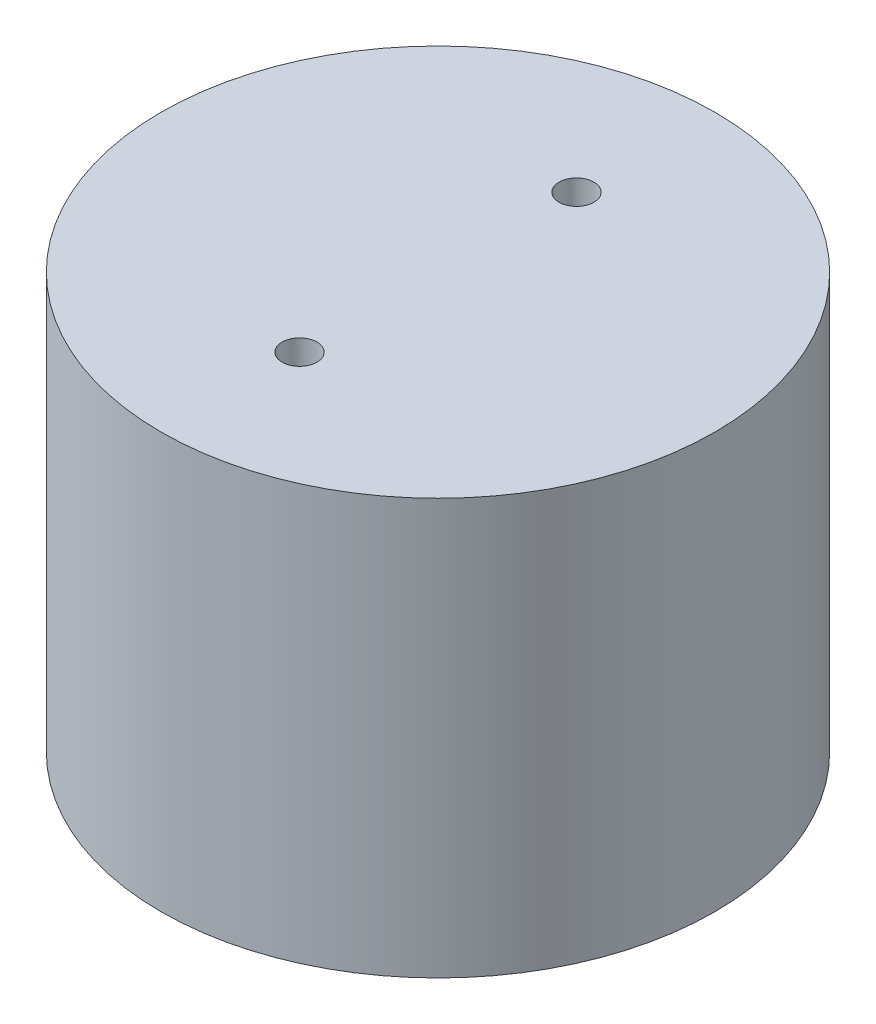
from build123d import *

# Parameters (mm, degrees)
SKETCH1_R                      = 25.4
BOSS_EXTRUDE1_DEPTH            = 38.1
F_1_4_20_TAPPED_HOLE4_D        = 5.1054
F_1_4_20_TAPPED_HOLE4_DEPTH    = 15.875
F_1_4_20_TAPPED_HOLE4_TIP      = 1.533816902
CBORE_FOR_M3_SHCS1_D           = 3.2
CBORE_FOR_M3_SHCS1_CBORE_D     = 6.5
CBORE_FOR_M3_SHCS1_CBORE_DEPTH = 4.999996


with BuildPart() as part:
    # Sketch1 → Boss-Extrude1 (new body)
    with BuildSketch(Plane(origin=(0, 0, 0), x_dir=(1, 0, 0), z_dir=(0, 1, 0))):
        Circle(SKETCH1_R)
    extrude(amount=BOSS_EXTRUDE1_DEPTH)

    # 1/4-20 Tapped Hole4
    with Locations(Plane(origin=(0, 0, 0), x_dir=(-1, 0, 0), z_dir=(0, -1, 0))):
        with Locations((12.7, 0), (-12.7, 0)):
            Hole(F_1_4_20_TAPPED_HOLE4_D / 2, depth=F_1_4_20_TAPPED_HOLE4_DEPTH)
            with Locations((0, 0, -(F_1_4_20_TAPPED_HOLE4_DEPTH + F_1_4_20_TAPPED_HOLE4_TIP / 2))):  # 118° drill point
                Cone(0, F_1_4_20_TAPPED_HOLE4_D / 2, F_1_4_20_TAPPED_HOLE4_TIP, mode=Mode.SUBTRACT)

    # CBORE for M3 SHCS1 (through all)
    with Locations(Plane(origin=(0, 0, 0), x_dir=(-1, 0, 0), z_dir=(0, -1, 0))):
        with Locations((0, -12.7), (0, 12.7)):
            CounterBoreHole(CBORE_FOR_M3_SHCS1_D / 2, CBORE_FOR_M3_SHCS1_CBORE_D / 2, CBORE_FOR_M3_SHCS1_CBORE_DEPTH)


solid = part.part
